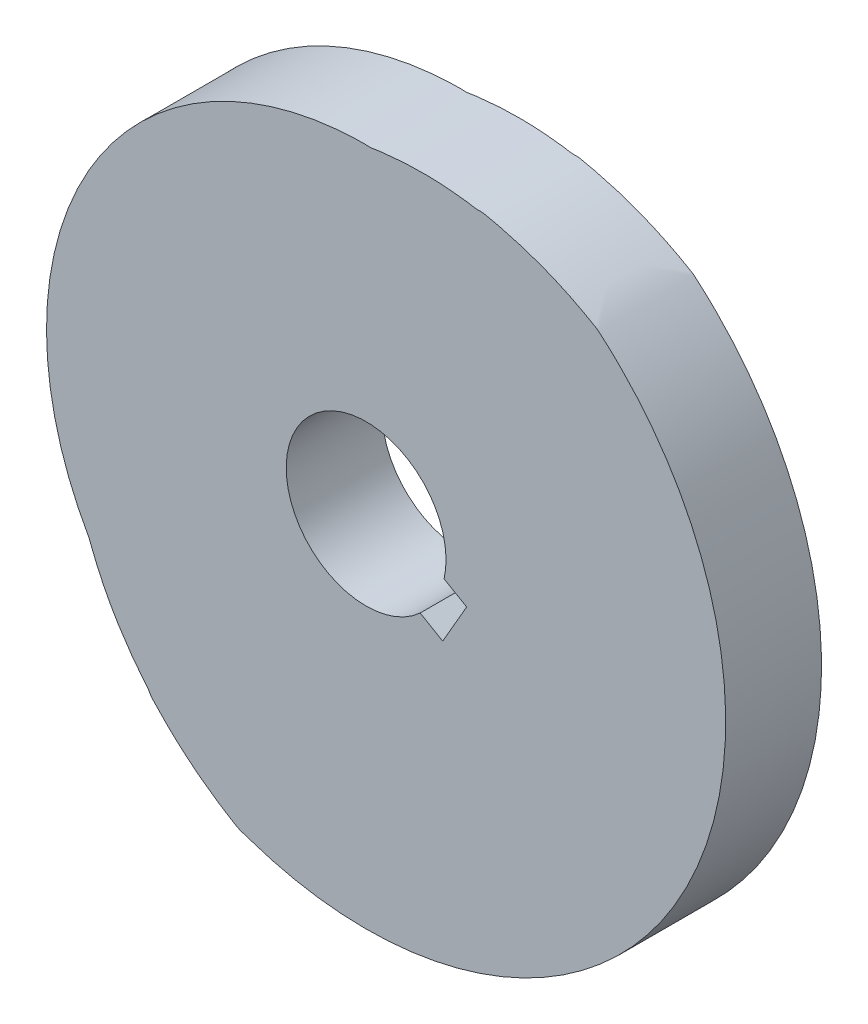
from build123d import *

# Parameters (mm, degrees)
EXTRUDE_1_DEPTH          = 12
CUT_EXTRUDE_1_DEPTH      = 12
CUT_EXTRUDE_1_DEPTH_BACK = 12


with BuildPart() as part:
    # 草图1 → 凸台-拉伸1 (new body)
    with BuildSketch(Plane.XY):
        with BuildLine():
            add(Edge.make_bspline(
                [(29.141275143, 34.289737284), (78.729934621, -7.853390201), (46.210728599, -64.223413998), (-15.095766438, -42.392426631), (-15.161192632, -42.369128636), (-15.291937149, -42.32222972), (-15.492584627, -42.265465013), (-15.625506497, -42.224792464), (-15.691081355, -42.201916245), (-16.092004567, -42.06205155), (-16.672651455, -41.686628222), (-17.486497964, -41.196333076), (-18.151136919, -40.768965213), (-18.807280436, -40.333138226), (-19.453468474, -39.886286366), (-20.0898817, -39.429353086), (-20.716268212, -38.962348602), (-21.332497058, -38.485535415), (-21.938409792, -37.99911127), (-22.533863042, -37.503295799), (-23.118706373, -36.998299305), (-23.692828449, -36.484360675), (-24.255995304, -35.961626798), (-24.808448953, -35.430594759), (-25.348683539, -34.890469551), (-25.881709857, -34.34526655), (-26.388342171, -33.781132666), (-26.946457766, -33.243769032), (-27.278063811, -32.541170902), (-27.810930975, -31.989555076), (-28.269634376, -31.398016217), (-28.731170366, -30.810678866), (-29.176845194, -30.21403838), (-29.611539128, -29.611997415), (-30.033848887, -29.003815705), (-30.44405344, -28.389992796), (-30.841988822, -27.770698476), (-31.227615108, -27.146191407), (-31.60086516, -26.516707327), (-31.961684979, -25.88248876), (-32.31002294, -25.243776984), (-32.645832662, -24.600814056), (-32.969072236, -23.953842162), (-33.279704424, -23.303103681), (-33.577696603, -22.648841057), (-33.86302075, -21.991296706), (-34.188365062, -21.202993938), (-34.409337731, -20.630229703), (-34.539531783, -20.277864342), (-34.562347094, -20.216115552), (-34.607668693, -20.092503792), (-34.691694065, -19.912291766), (-34.75695219, -19.797944537), (-34.789439917, -19.740690724), (-51.699840074, 10.060867816), (-34.569943206, 39.736803491), (-0.305882343, 39.998830433), (-0.238002099, 39.999349532), (-0.102238967, 40.000042141), (0.101034894, 39.983136654), (0.236678074, 39.975126898), (0.304549507, 39.973916231), (0.673304877, 39.967338504), (1.26956909, 40.092379688), (2.107091781, 40.195513913), (2.81687014, 40.279270985), (3.530341307, 40.347979908), (4.247030455, 40.404684139), (4.966779672, 40.448445358), (5.689342877, 40.479402111), (6.414494921, 40.497408079), (7.142002395, 40.50239953), (7.87163127, 40.494293187), (8.603146102, 40.47302613), (9.336305985, 40.438498799), (10.070882053, 40.390764), (10.806591724, 40.329325319), (11.543345691, 40.25576536), (12.280322436, 40.163894814), (13.019437658, 40.076676934), (13.762708355, 39.905436173), (14.531391926, 39.984479792), (15.275501432, 39.784393984), (16.015912596, 39.64226701), (16.753745963, 39.467846464), (17.490961928, 39.284699492), (18.226709712, 39.086465646), (18.960893956, 38.874843768), (19.693215091, 38.649370051), (20.423427676, 38.410168677), (21.151270992, 38.157211689), (21.876487836, 37.890518168), (22.598819574, 37.610100662), (23.318007587, 37.315979621), (24.033792996, 37.008179533), (24.745916855, 36.686729975), (25.454120209, 36.351665348), (26.158144205, 36.003024963), (26.857730151, 35.640853011), (27.704246569, 35.18322979), (28.311736149, 34.835944342), (28.687343653, 34.613813474), (28.740685418, 34.582267639), (28.847236915, 34.51895271), (28.999443267, 34.409937689), (29.094053118, 34.329869117), (29.141275143, 34.289737284)],
                knots=[0, 0, 0, 0, 0.403815645, 0.403815645, 0.403815645, 0.404766038, 0.405716431, 0.406666825, 0.406666825, 0.406666825, 0.412477509, 0.416098194, 0.419709031, 0.423310021, 0.426901165, 0.430482463, 0.434053917, 0.437615526, 0.441167292, 0.444709215, 0.448241296, 0.451763536, 0.455275935, 0.458778495, 0.462271216, 0.465754098, 0.469227143, 0.472690351, 0.476278013, 0.479711716, 0.483135585, 0.486549622, 0.489953827, 0.4933482, 0.496732744, 0.500107458, 0.503472343, 0.506827401, 0.510172632, 0.513508037, 0.516833617, 0.520149372, 0.523455304, 0.526751414, 0.530037702, 0.53331417, 0.536580818, 0.541732396, 0.541732396, 0.541732396, 0.542635162, 0.543537929, 0.544440695, 0.544440695, 0.544440695, 0.859756761, 0.859756761, 0.859756761, 0.860687685, 0.86161861, 0.862549535, 0.862549535, 0.862549535, 0.867607385, 0.870866645, 0.874135732, 0.877414645, 0.880703386, 0.884001957, 0.887310357, 0.890628587, 0.893956649, 0.897294544, 0.900642272, 0.903999834, 0.907367231, 0.910744464, 0.914131534, 0.917528442, 0.920935188, 0.924351773, 0.927923197, 0.931369305, 0.934825255, 0.938291048, 0.941766686, 0.945252168, 0.948747496, 0.95225267, 0.955767691, 0.95929256, 0.962827278, 0.966371845, 0.969926262, 0.97349053, 0.977064649, 0.980648621, 0.984242445, 0.987846124, 0.991459656, 0.997448493, 0.997448493, 0.997448493, 0.998298995, 0.999149498, 1, 1, 1, 1], degree=3, weights=[1, 0.453445281, 0.453445281, 1, 1, 1, 1, 1, 1, 1, 1, 1, 1, 1, 1, 1, 1, 1, 1, 1, 1, 1, 1, 1, 1, 1, 1, 1, 1, 1, 1, 1, 1, 1, 1, 1, 1, 1, 1, 1, 1, 1, 1, 1, 1, 1, 1, 1, 1, 1, 1, 1, 1, 1, 0.671020922, 0.671020922, 1, 1, 1, 1, 1, 1, 1, 1, 1, 1, 1, 1, 1, 1, 1, 1, 1, 1, 1, 1, 1, 1, 1, 1, 1, 1, 1, 1, 1, 1, 1, 1, 1, 1, 1, 1, 1, 1, 1, 1, 1, 1, 1, 1, 1, 1, 1, 1, 1, 1, 1]))
        make_face()
    extrude(amount=EXTRUDE_1_DEPTH)

    # 草图2 → 切除-拉伸1 (cut, two sides: drawn at the far end of the back side and taken through both)
    with BuildSketch(Plane.XY.offset(-CUT_EXTRUDE_1_DEPTH_BACK)):
        with BuildLine():
            Line((9.761355821, -2.171619796), (12.585125127, -3.801923765))
            Line((12.585125127, -3.801923765), (9.585125127, -8.998076188))
            Line((9.585125127, -8.998076188), (6.761355821, -7.367772218))
            ThreePointArc((6.761355821, -7.367772218), (-8.660254038, 5), (9.761355821, -2.171619796))
        make_face()
    extrude(amount=CUT_EXTRUDE_1_DEPTH + CUT_EXTRUDE_1_DEPTH_BACK, mode=Mode.SUBTRACT)


solid = part.part
